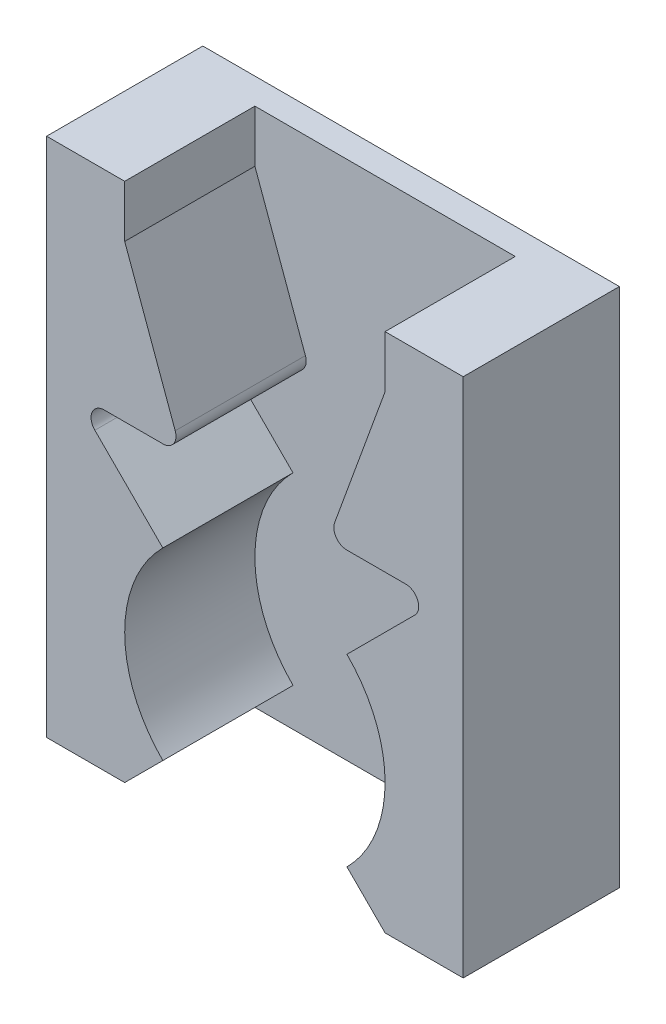
from build123d import *

# Parameters (mm, degrees)
BOSS_EXTRUDE1_DEPTH   = 50
BOSS_EXTRUDE1_2_DEPTH = 50
SKETCH3_W             = 160
SKETCH3_H             = 200
BOSS_EXTRUDE2_DEPTH   = 10
FILLET1_R             = 5


with BuildPart() as part:
    # Sketch2 → Boss-Extrude1 (new body)
    with BuildSketch(Plane.XY):
        with BuildLine():
            Line((-70, 20), (-35.355339059, -14.644660941))
            ThreePointArc((-35.355339059, -14.644660941), (-50, -50), (-35.355339059, -85.355339059))
            Line((-35.355339059, -85.355339059), (-50, -100))
            Line((-50, -100), (-80, -100))
            Line((-80, -100), (-80, 100))
            Line((-80, 100), (-50, 100))
            Line((-50, 100), (-50, 80))
            Line((-50, 80), (-28.161785944, 20))
            Line((-28.161785944, 20), (-70, 20))
        make_face()
    extrude(amount=-BOSS_EXTRUDE1_DEPTH)



with BuildPart() as body_2:
    # Sketch2 → Boss-Extrude1 2 (new body)
    with BuildSketch(Plane.XY):
        with BuildLine():
            Line((70, 20), (35.355339059, -14.644660941))
            ThreePointArc((35.355339059, -14.644660941), (50, -50), (35.355339059, -85.355339059))
            Line((35.355339059, -85.355339059), (50, -100))
            Line((50, -100), (80, -100))
            Line((80, -100), (80, 100))
            Line((80, 100), (50, 100))
            Line((50, 100), (50, 80))
            Line((50, 80), (28.161785944, 20))
            Line((28.161785944, 20), (70, 20))
        make_face()
    extrude(amount=-BOSS_EXTRUDE1_2_DEPTH)


with BuildPart() as part_1:
    add(part.part)

    add(body_2.part)  # Boss-Extrude2 merges body 2
    # Sketch3 → Boss-Extrude2 (add)
    with BuildSketch(Plane(origin=(0, 0, -50), x_dir=(-1, 0, 0), z_dir=(0, 0, -1))):
        Rectangle(SKETCH3_W, SKETCH3_H)
    extrude(amount=BOSS_EXTRUDE2_DEPTH)

    # Fillet1
    fillet1_edges = [part_1.edges().sort_by_distance(p)[0] for p in [
        (-28.161785944, 20, -25),
        (-70, 20, -25),
        (70, 20, -25),
        (28.161785944, 20, -25),
    ]]
    fillet(fillet1_edges, radius=FILLET1_R)


solid = part_1.part
